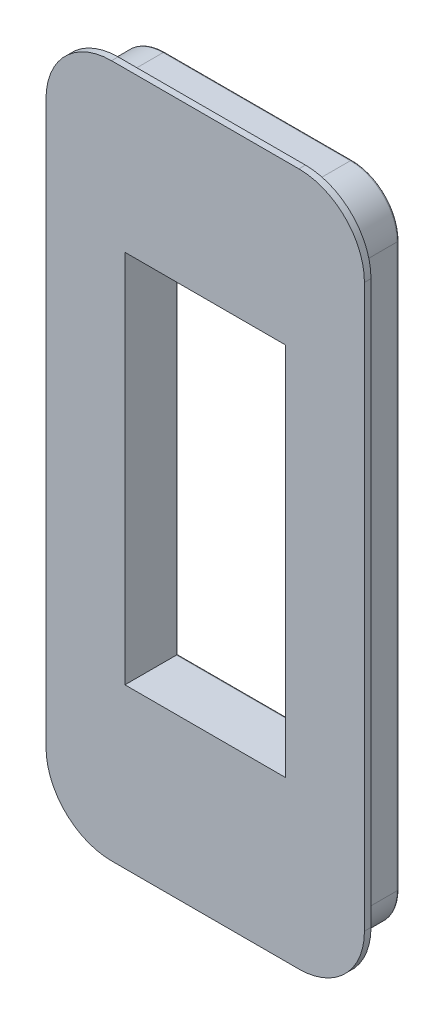
from build123d import *

# Parameters (mm, degrees)
SKETCH4_W           = 30
SKETCH4_H           = 70
SKETCH4_R           = 3.5
SKETCH4_W_2         = 17.142857142
SKETCH4_H_2         = 40
BOSS_EXTRUDE1_DEPTH = 5
SKETCH5_W           = 34
SKETCH5_H           = 74
SKETCH5_W_2         = 30
SKETCH5_H_2         = 70
SKETCH5_R           = 3.5
SKETCH5_W_3         = 17.142857142
SKETCH5_H_3         = 40
BOSS_EXTRUDE2_DEPTH = 0.7
FILLET1_R           = 5
FILLET2_R           = 0.2
FILLET3_R           = 7


with BuildPart() as part:
    # Sketch4 → Boss-Extrude1 (new body)
    with BuildSketch(Plane.XY):
        Rectangle(SKETCH4_W, SKETCH4_H)
        with Locations((7.5, 28)):
            Circle(SKETCH4_R, mode=Mode.SUBTRACT)
        with Locations((-7.5, 28)):
            Circle(SKETCH4_R, mode=Mode.SUBTRACT)
        with Locations((7.5, -28)):
            Circle(SKETCH4_R, mode=Mode.SUBTRACT)
        with Locations((-7.5, -28)):
            Circle(SKETCH4_R, mode=Mode.SUBTRACT)
        Rectangle(SKETCH4_W_2, SKETCH4_H_2, mode=Mode.SUBTRACT)
    extrude(amount=BOSS_EXTRUDE1_DEPTH)

    # Sketch5 → Boss-Extrude2 (add)
    # profile 1 of 6: a face of its own
    with BuildSketch(Plane.XY.offset(5)):
        Rectangle(SKETCH5_W, SKETCH5_H)
        Rectangle(SKETCH5_W_2, SKETCH5_H_2, mode=Mode.SUBTRACT)
    # profile 2 of 6: a face of its own
    with BuildSketch(Plane.XY.offset(5)):
        Rectangle(SKETCH5_W_2, SKETCH5_H_2)
        with Locations((-7.5, 28)):
            Circle(SKETCH5_R, mode=Mode.SUBTRACT)
        with Locations((-7.5, -28)):
            Circle(SKETCH5_R, mode=Mode.SUBTRACT)
        with Locations((7.5, -28)):
            Circle(SKETCH5_R, mode=Mode.SUBTRACT)
        with Locations((7.5, 28)):
            Circle(SKETCH5_R, mode=Mode.SUBTRACT)
        Rectangle(SKETCH5_W_3, SKETCH5_H_3, mode=Mode.SUBTRACT)
    # profile 3 of 6: a face of its own
    with BuildSketch(Plane.XY.offset(5)):
        with Locations((7.5, -28)):
            Circle(SKETCH5_R)
    # profile 4 of 6: a face of its own
    with BuildSketch(Plane.XY.offset(5)):
        with Locations((-7.5, -28)):
            Circle(SKETCH5_R)
    # profile 5 of 6: a face of its own
    with BuildSketch(Plane.XY.offset(5)):
        with Locations((7.5, 28)):
            Circle(SKETCH5_R)
    # profile 6 of 6: a face of its own
    with BuildSketch(Plane.XY.offset(5)):
        with Locations((-7.5, 28)):
            Circle(SKETCH5_R)
    extrude(amount=BOSS_EXTRUDE2_DEPTH)

    # Fillet1
    fillet1_edges = [part.edges().sort_by_distance(p)[0] for p in [
        (-15, 35, 2.5),
        (15, 35, 2.5),
        (15, -35, 2.5),
        (-15, -35, 2.5),
    ]]
    fillet(fillet1_edges, radius=FILLET1_R)

    # Fillet2
    fillet2_edges = [part.edges().sort_by_distance(p)[0] for p in [
        (-11, -28, 0),
        (4, -28, 0),
        (8.571428571, 0, 0),
        (0, 20, 0),
        (-8.571428571, 0, 0),
        (0, -20, 0),
        (-11, 28, 0),
        (4, 28, 0),
        (15, 0, 0),
        (-15, 0, 0),
        (0, 35, 0),
        (0, -35, 0),
        (13.535533906, 33.535533906, 0),
        (-13.535533906, 33.535533906, 0),
        (-13.535533906, -33.535533906, 0),
        (13.535533906, -33.535533906, 0),
    ]]
    fillet(fillet2_edges, radius=FILLET2_R)

    # Fillet3
    fillet3_edges = [part.edges().sort_by_distance(p)[0] for p in [
        (17, 37, 5.35),
        (-17, 37, 5.35),
        (-17, -37, 5.35),
        (17, -37, 5.35),
    ]]
    fillet(fillet3_edges, radius=FILLET3_R)


solid = part.part
